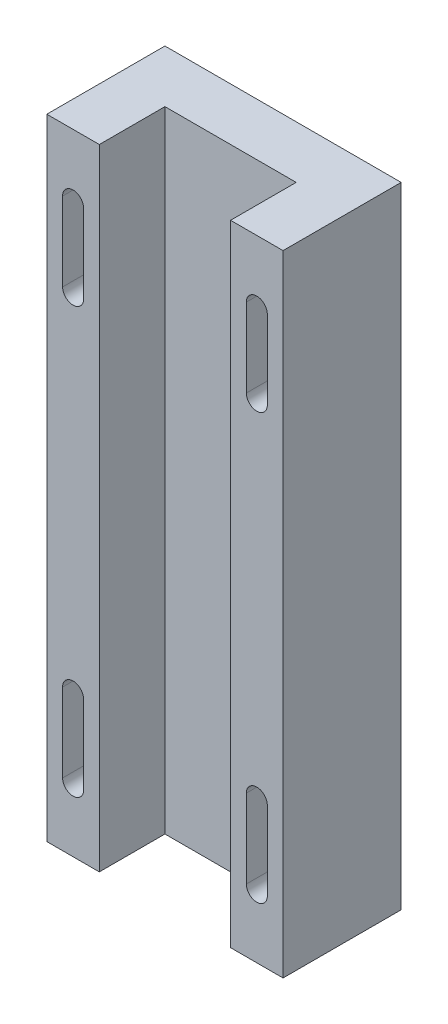
from build123d import *

# Parameters (mm, degrees)
BOSS_EXTRUDE1_DEPTH  = 120
CUT_EXTRUDE1_DEPTH   = 4
MIRROR2_COPY_1_DEPTH = 4


with BuildPart() as part:
    # Sketch2 → Boss-Extrude1 (new body)
    with BuildSketch(Plane(origin=(0, 0, 0), x_dir=(1, 0, 0), z_dir=(0, 1, 0))):
        Polygon((0, 0), (-10, 0), (-10, 22.5), (35, 22.5), (35, 0), (25, 0), (25, 12.5), (0, 12.5), align=None)
    extrude(amount=BOSS_EXTRUDE1_DEPTH)

    # Sketch3 → Cut-Extrude1 (cut)
    with BuildSketch(Plane.XY):
        with BuildLine():
            Line((28, 108), (28, 93))
            ThreePointArc((28, 93), (30, 91), (32, 93))
            Line((32, 93), (32, 108))
            ThreePointArc((32, 108), (30, 110), (28, 108))
        make_face()
    cut_extrude1 = extrude(amount=-CUT_EXTRUDE1_DEPTH, mode=Mode.SUBTRACT)

    # Mirror1: Cut-Extrude1 across plane
    add(cut_extrude1.mirror(Plane.ZY.offset(-12.5)), mode=Mode.SUBTRACT)

    # Mirror2: Cut-Extrude1 across plane
    add(cut_extrude1.mirror(Plane(origin=(0, 60, 0), x_dir=(0, 0, 1), z_dir=(0, -1, 0))), mode=Mode.SUBTRACT)

    # Mirror2 copy 1 sketch → Mirror2 copy 1 (cut)
    with BuildSketch(Plane(origin=(25, 120, 0), x_dir=(-1, 0, 0), z_dir=(0, 0, 1))):
        with BuildLine():
            Line((28, 108), (28, 93))
            ThreePointArc((28, 93), (30, 91), (32, 93))
            Line((32, 93), (32, 108))
            ThreePointArc((32, 108), (30, 110), (28, 108))
        make_face()
    extrude(amount=-MIRROR2_COPY_1_DEPTH, mode=Mode.SUBTRACT)


solid = part.part
